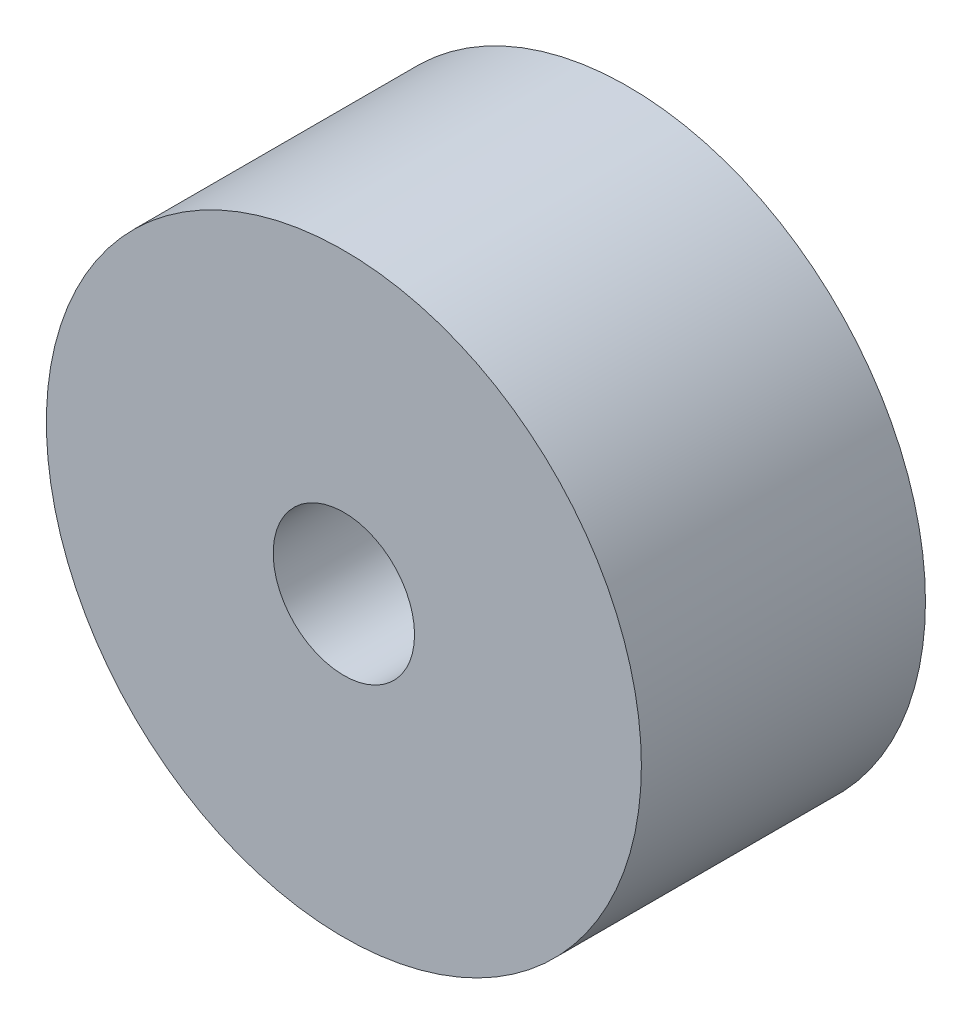
from build123d import *

# Parameters (mm, degrees)
SKETCH1_R           = 21.05
SKETCH1_R_2         = 5
BOSS_EXTRUDE1_DEPTH = 10.05


with BuildPart() as part:
    # Sketch1 → Boss-Extrude1 (new, symmetric)
    with BuildSketch(Plane.XY):
        Circle(SKETCH1_R)
        Circle(SKETCH1_R_2, mode=Mode.SUBTRACT)
    extrude(amount=BOSS_EXTRUDE1_DEPTH, both=True)


solid = part.part
